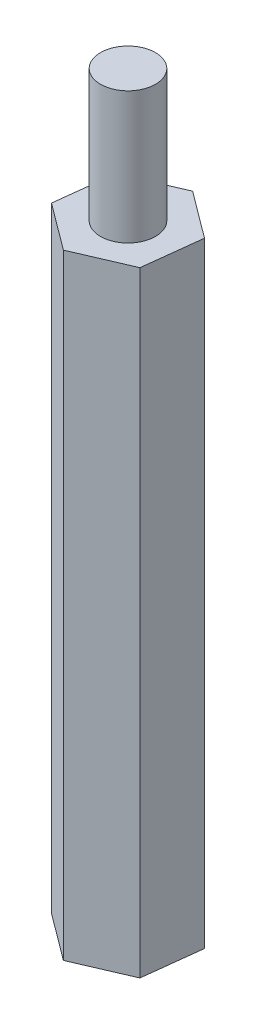
from build123d import *

# Parameters (mm, degrees)
EXTRUDE_1_DEPTH     = 28
SKETCH_2_R          = 1.25
EXTRUDE_2_DEPTH     = 6
SKETCH_3_R          = 1.25
CUT_EXTRUDE_1_DEPTH = 6


with BuildPart() as part:
    # 草图1 → 凸台-拉伸1 (new body)
    with BuildSketch(Plane(origin=(0, 0, 0), x_dir=(1, 0, 0), z_dir=(0, 1, 0))):
        Polygon((2.125123473, -1.583145674), (2.433606108, 1.048838076), (0.308482635, 2.631983751), (-2.125123473, 1.583145674), (-2.433606108, -1.048838076), (-0.308482635, -2.631983751), align=None)
    extrude(amount=EXTRUDE_1_DEPTH)

    # 草图2 → 凸台-拉伸2 (add)
    with BuildSketch(Plane(origin=(0, 28, 0), x_dir=(1, 0, 0), z_dir=(0, 1, 0))):
        with Locations(Location((0, 0, 0), (0, 0, 270))):
            Circle(SKETCH_2_R)
    extrude(amount=EXTRUDE_2_DEPTH)

    # 草图3 → 切除-拉伸1 (cut)
    with BuildSketch(Plane.XZ):
        with Locations(Location((0, 0, 0), (0, 0, 90))):
            Circle(SKETCH_3_R)
    extrude(amount=-CUT_EXTRUDE_1_DEPTH, mode=Mode.SUBTRACT)


solid = part.part
